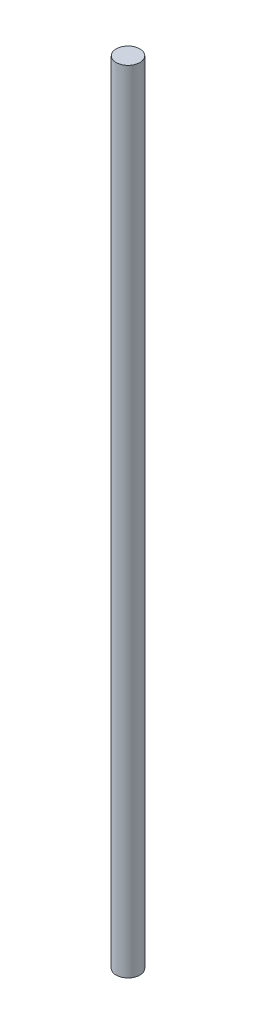
from build123d import *

# Parameters (mm, degrees)
SKETCH2_R           = 1.5
BOSS_EXTRUDE1_DEPTH = 100


with BuildPart() as part:
    # Sketch2 → Boss-Extrude1 (new body)
    with BuildSketch(Plane(origin=(0, 0, 0), x_dir=(1, 0, 0), z_dir=(0, 1, 0))):
        with Locations(Location((0, 0, 0), (0, 0, 270))):
            Circle(SKETCH2_R)
    extrude(amount=BOSS_EXTRUDE1_DEPTH)


solid = part.part
